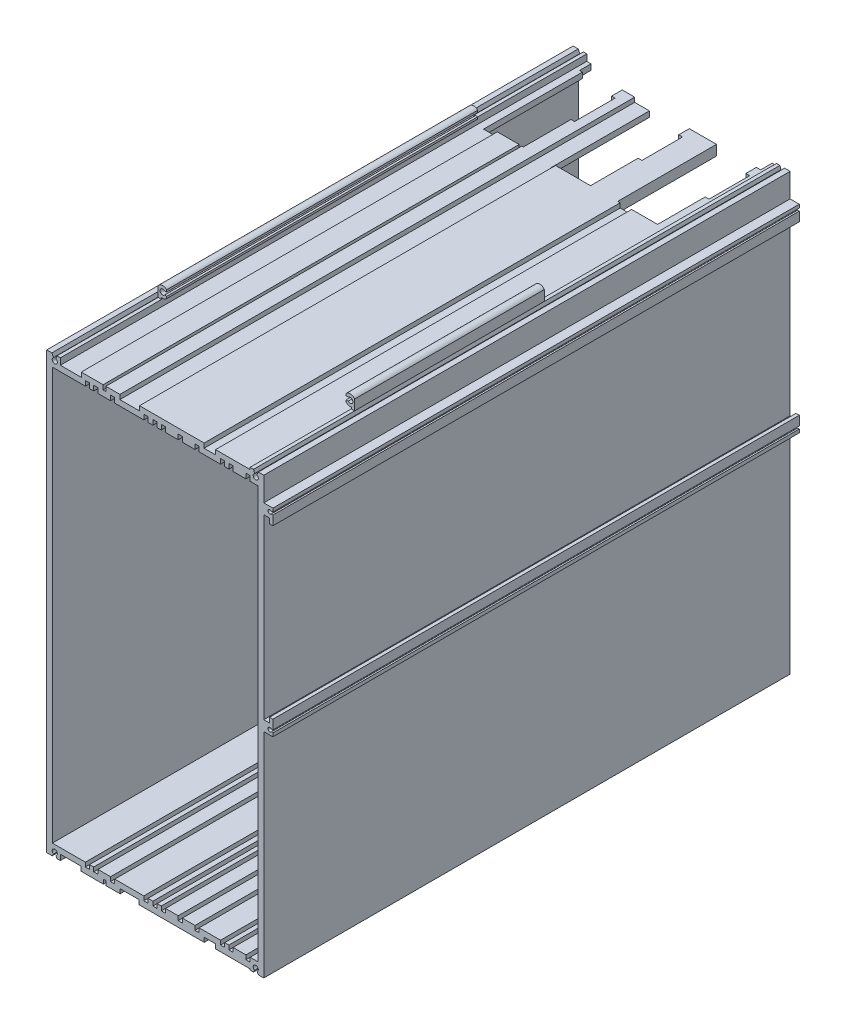
from build123d import *

# Parameters (mm, degrees)
BOSS_EXTRUDE1_DEPTH = 308
BOSS_EXTRUDE2_DEPTH = 188.8
CUT_EXTRUDE3_REACH  = 428.294
SKETCH4_W           = 77.8
SKETCH4_H           = 20.823727225
CUT_EXTRUDE4_REACH  = 424.481
SKETCH5_W           = 106
SKETCH5_H           = 6.75
CUT_EXTRUDE5_REACH  = 424.481
SKETCH6_W           = 23.35
SKETCH6_H           = 57.8
CUT_EXTRUDE6_REACH  = 429.843
SKETCH7_W           = 66.8
SKETCH7_H           = 11.633150893
CUT_EXTRUDE7_REACH  = 424.481
SKETCH8_W           = 2.25
SKETCH8_H           = 23.75


with BuildPart() as part:
    # Sketch2 → Boss-Extrude1 (new body)
    with BuildSketch(Plane.XY):
        with BuildLine():
            Line((14.499999531, 257.585773296), (14.499999531, 261.373383253))
            Line((14.499999531, 261.373383253), (12.499999531, 261.373383253))
            Line((12.499999531, 261.373383253), (11.766447114, 259.574707108))
            ThreePointArc((11.766447114, 259.574707108), (12.4449235, 259.022531512), (12.699999531, 258.185773296))
            ThreePointArc((12.699999531, 258.185773296), (10.428246686, 256.899539434), (10.494136136, 259.509312818))
            Line((10.494136136, 259.509312818), (9.499999531, 261.373383253))
            Line((9.499999531, 261.373383253), (6.499999531, 261.373383253))
            Line((6.499999531, 261.373383253), (6.499999531, 6.573383253))
            Line((6.499999531, 6.573383253), (9.699999531, 6.573383253))
            Line((9.699999531, 6.573383253), (10.453087922, 7.884956995))
            ThreePointArc((10.453087922, 7.884956995), (10.448456922, 10.483919553), (12.699999531, 9.185773296))
            ThreePointArc((12.699999531, 9.185773296), (12.47478685, 8.395256191), (11.866776475, 7.842118389))
            Line((11.866776475, 7.842118389), (12.496375142, 6.573383253))
            Line((12.496375142, 6.573383253), (14.496375142, 6.573383253))
            Line((14.496375142, 6.573383253), (14.496375142, 9.785773296))
            Line((14.496375142, 9.785773296), (26.596375142, 9.785773296))
            Line((26.596375142, 9.785773296), (26.596375142, 7.202035453))
            Line((26.596375142, 7.202035453), (39.696375142, 7.202035453))
            Line((39.696375142, 7.202035453), (39.696375142, 9.785773296))
            Line((39.696375142, 9.785773296), (41.199999531, 9.785773296))
            Line((41.199999531, 9.785773296), (41.199999531, 7.202035453))
            Line((41.199999531, 7.202035453), (49.449999531, 7.202035453))
            Line((49.449999531, 7.202035453), (49.449999531, 9.785773296))
            Line((49.449999531, 9.785773296), (60.549999531, 9.785773296))
            Line((60.549999531, 9.785773296), (60.549999531, 7.202035453))
            Line((60.549999531, 7.202035453), (98.649999531, 7.202035453))
            Line((98.649999531, 7.202035453), (98.649999531, 9.785773296))
            Line((98.649999531, 9.785773296), (105.249999531, 9.785773296))
            Line((105.249999531, 9.785773296), (105.249999531, 7.202035453))
            Line((105.249999531, 7.202035453), (125.499999531, 7.202035453))
            Line((125.499999531, 7.202035453), (125.499999531, 6.573383253))
            Line((125.499999531, 6.573383253), (127.499999531, 6.573383253))
            Line((127.499999531, 6.573383253), (128.131728013, 7.842861095))
            ThreePointArc((128.131728013, 7.842861095), (128.010191731, 10.461000193), (130.299999531, 9.185773296))
            ThreePointArc((130.299999531, 9.185773296), (130.098145789, 8.434230687), (129.54691114, 7.884956995))
            Line((129.54691114, 7.884956995), (130.299999531, 6.573383253))
            Line((130.299999531, 6.573383253), (133.499999531, 6.573383253))
            Line((133.499999531, 6.573383253), (133.499999531, 131.473383253))
            Line((133.499999531, 131.473383253), (138.849999531, 131.473383253))
            Line((138.849999531, 131.473383253), (138.849999531, 133.473383253))
            Line((138.849999531, 133.473383253), (137.935232058, 133.473383253))
            ThreePointArc((137.935232058, 133.473383253), (135.950499999, 134.164830282), (137.890474853, 134.973383253))
            Line((137.890474853, 134.973383253), (138.849999531, 134.973383253))
            Line((138.849999531, 134.973383253), (138.849999531, 140.423383253))
            Line((138.849999531, 140.423383253), (136.899999531, 140.423383253))
            Line((136.899999531, 140.423383253), (136.899999531, 137.473383253))
            Line((136.899999531, 137.473383253), (133.499999531, 137.473383253))
            Line((133.499999531, 137.473383253), (133.499999531, 241.373383253))
            Line((133.499999531, 241.373383253), (136.899999531, 241.373383253))
            Line((136.899999531, 241.373383253), (136.899999531, 238.423383253))
            Line((136.899999531, 238.423383253), (138.849999531, 238.423383253))
            Line((138.849999531, 238.423383253), (138.849999531, 243.873383253))
            Line((138.849999531, 243.873383253), (137.890474853, 243.873383253))
            ThreePointArc((137.890474853, 243.873383253), (135.950499999, 244.681936224), (137.935232058, 245.373383253))
            Line((137.935232058, 245.373383253), (138.849999531, 245.373383253))
            Line((138.849999531, 245.373383253), (138.849999531, 247.373383253))
            Line((138.849999531, 247.373383253), (133.499999531, 247.373383253))
            Line((133.499999531, 247.373383253), (133.499999531, 261.373383253))
            Line((133.499999531, 261.373383253), (130.299999531, 261.373383253))
            Line((130.299999531, 261.373383253), (129.438677048, 259.543009837))
            ThreePointArc((129.438677048, 259.543009837), (130.06649396, 258.989509485), (130.299999531, 258.185773296))
            ThreePointArc((130.299999531, 258.185773296), (127.963241315, 256.940849327), (128.233551948, 259.574707108))
            Line((128.233551948, 259.574707108), (127.499999531, 261.373383253))
            Line((127.499999531, 261.373383253), (125.499999531, 261.373383253))
            Line((125.499999531, 261.373383253), (125.499999531, 260.239968056))
            Line((125.499999531, 260.239968056), (105.299999531, 260.239968056))
            Line((105.299999531, 260.239968056), (105.299999531, 257.585773296))
            Line((105.299999531, 257.585773296), (98.599999531, 257.585773296))
            Line((98.599999531, 257.585773296), (98.599999531, 260.239968056))
            Line((98.599999531, 260.239968056), (60.799999531, 260.239968056))
            Line((60.799999531, 260.239968056), (60.799999531, 257.585773296))
            Line((60.799999531, 257.585773296), (49.299999531, 257.585773296))
            Line((49.299999531, 257.585773296), (49.299999531, 260.239968056))
            Line((49.299999531, 260.239968056), (41.099999531, 260.239968056))
            Line((41.099999531, 260.239968056), (41.099999531, 257.585773296))
            Line((41.099999531, 257.585773296), (39.499999531, 257.585773296))
            Line((39.499999531, 257.585773296), (39.499999531, 260.239968056))
            Line((39.499999531, 260.239968056), (26.699999531, 260.239968056))
            Line((26.699999531, 260.239968056), (26.699999531, 257.585773296))
            Line((26.699999531, 257.585773296), (14.499999531, 257.585773296))
        make_face()
        Polygon((9.799999531, 13.085773296), (9.799999531, 254.285773296), (29.099999531, 254.285773296), (29.099999531, 257.185773296), (31.549999531, 257.185773296), (31.549999531, 254.285773296), (33.999999531, 254.285773296), (33.999999531, 257.185773296), (36.449999531, 257.185773296), (36.449999531, 254.285773296), (43.849999531, 254.285773296), (43.849999531, 257.185773296), (46.299999531, 257.185773296), (46.299999531, 254.285773296), (63.299999531, 254.285773296), (63.299999531, 257.185773296), (65.749999531, 257.185773296), (65.749999531, 254.285773296), (68.649999531, 254.285773296), (68.649999531, 257.185773296), (71.099999531, 257.185773296), (71.099999531, 254.285773296), (73.549999531, 254.285773296), (73.549999531, 257.185773296), (75.999999531, 257.185773296), (75.999999531, 254.285773296), (83.399999531, 254.285773296), (83.399999531, 257.185773296), (85.849999531, 257.185773296), (85.849999531, 254.285773296), (93.249999531, 254.285773296), (93.249999531, 257.185773296), (95.699999531, 257.185773296), (95.699999531, 254.285773296), (108.199999531, 254.285773296), (108.199999531, 257.185773296), (110.649999531, 257.185773296), (110.649999531, 254.285773296), (113.099999531, 254.285773296), (113.099999531, 257.185773296), (115.549999531, 257.185773296), (115.549999531, 254.285773296), (123.049999531, 254.285773296), (123.049999531, 257.185773296), (125.499999531, 257.185773296), (125.499999531, 254.285773296), (130.199999531, 254.285773296), (130.199999531, 13.085773296), (125.499999531, 13.085773296), (125.499999531, 10.605647121), (123.049999531, 10.605647121), (123.049999531, 13.085773296), (115.549999531, 13.085773296), (115.549999531, 10.605647121), (113.099999531, 10.605647121), (113.099999531, 13.085773296), (110.649999531, 13.085773296), (110.649999531, 10.605647121), (108.199999531, 10.605647121), (108.199999531, 13.085773296), (95.699999531, 13.085773296), (95.699999531, 10.605647121), (93.249999531, 10.605647121), (93.249999531, 13.085773296), (85.849999531, 13.085773296), (85.849999531, 10.605647121), (83.399999531, 10.605647121), (83.399999531, 13.085773296), (75.999999531, 13.085773296), (75.999999531, 10.605647121), (73.549999531, 10.605647121), (73.549999531, 13.085773296), (71.099999531, 13.085773296), (71.099999531, 10.605647121), (68.649999531, 10.605647121), (68.649999531, 13.085773296), (65.749999531, 13.085773296), (65.749999531, 10.605647121), (63.299999531, 10.605647121), (63.299999531, 13.085773296), (46.299999531, 13.085773296), (46.299999531, 10.605647121), (43.849999531, 10.605647121), (43.849999531, 13.085773296), (36.449999531, 13.085773296), (36.449999531, 10.605647121), (33.999999531, 10.605647121), (33.999999531, 13.085773296), (31.549999531, 13.085773296), (31.549999531, 10.605647121), (29.099999531, 10.605647121), (29.099999531, 13.085773296), align=None, mode=Mode.SUBTRACT)
    extrude(amount=BOSS_EXTRUDE1_DEPTH)

    # Sketch3 → Boss-Extrude2 (add)
    with BuildSketch(Plane(origin=(0, 0, 60), x_dir=(-1, 0, 0), z_dir=(0, 0, -1))):
        with BuildLine():
            ThreePointArc((-17.499999531, 263.24640733), (-16.121371693, 262.388956123), (-14.499999531, 262.30535229))
            Line((-14.499999531, 262.30535229), (-14.499999531, 264.027871507))
            ThreePointArc((-14.499999531, 264.027871507), (-15.443429897, 263.94278526), (-16.249723759, 264.439968056))
            Line((-16.249723759, 264.439968056), (-17.499999531, 264.439968056))
            Line((-17.499999531, 264.439968056), (-17.499999531, 263.24640733))
        make_face()
        with BuildLine():
            Line((-14.499999531, 264.027871507), (-14.499999531, 262.30535229))
            ThreePointArc((-14.499999531, 262.30535229), (-13.376269152, 262.765773779), (-12.499999531, 263.606552859))
            Line((-12.499999531, 263.606552859), (-12.499999531, 267.373383253))
            ThreePointArc((-12.499999531, 267.373383253), (-13.376269152, 268.214162333), (-14.499999531, 268.674583822))
            Line((-14.499999531, 268.674583822), (-14.499999531, 266.777802835))
            ThreePointArc((-14.499999531, 266.777802835), (-13.844699353, 266.224622869), (-13.59955722, 265.402837171))
            ThreePointArc((-13.59955722, 265.402837171), (-13.844699353, 264.581051473), (-14.499999531, 264.027871507))
        make_face()
        with BuildLine():
            Line((-14.499999531, 262.30535229), (-14.499999531, 261.373383253))
            Line((-14.499999531, 261.373383253), (-12.499999531, 261.373383253))
            Line((-12.499999531, 261.373383253), (-12.499999531, 263.606552859))
            ThreePointArc((-12.499999531, 263.606552859), (-13.376269152, 262.765773779), (-14.499999531, 262.30535229))
        make_face()
        with BuildLine():
            ThreePointArc((-16.077786922, 266.539968056), (-15.323140468, 266.886080418), (-14.499999531, 266.777802835))
            Line((-14.499999531, 266.777802835), (-14.499999531, 268.674583822))
            ThreePointArc((-14.499999531, 268.674583822), (-16.121371693, 268.590979989), (-17.499999531, 267.733528783))
            Line((-17.499999531, 267.733528783), (-17.499999531, 266.539968056))
            Line((-17.499999531, 266.539968056), (-16.077786922, 266.539968056))
        make_face()
        with BuildLine():
            Line((-127.499999531, 263.606552859), (-127.499999531, 261.373383253))
            Line((-127.499999531, 261.373383253), (-125.499999531, 261.373383253))
            Line((-125.499999531, 261.373383253), (-125.499999531, 262.30535229))
            ThreePointArc((-125.499999531, 262.30535229), (-126.62372991, 262.765773779), (-127.499999531, 263.606552859))
        make_face()
        with BuildLine():
            Line((-127.499999531, 267.373383253), (-127.499999531, 263.606552859))
            ThreePointArc((-127.499999531, 263.606552859), (-126.62372991, 262.765773779), (-125.499999531, 262.30535229))
            Line((-125.499999531, 262.30535229), (-125.499999531, 264.027871507))
            ThreePointArc((-125.499999531, 264.027871507), (-126.400441842, 265.402837171), (-125.499999531, 266.777802835))
            Line((-125.499999531, 266.777802835), (-125.499999531, 268.674583822))
            ThreePointArc((-125.499999531, 268.674583822), (-126.62372991, 268.214162333), (-127.499999531, 267.373383253))
        make_face()
        with BuildLine():
            ThreePointArc((-122.499999531, 267.733528783), (-123.878627369, 268.590979989), (-125.499999531, 268.674583822))
            Line((-125.499999531, 268.674583822), (-125.499999531, 266.777802835))
            ThreePointArc((-125.499999531, 266.777802835), (-124.676858594, 266.886080418), (-123.922212141, 266.539968056))
            Line((-123.922212141, 266.539968056), (-122.499999531, 266.539968056))
            Line((-122.499999531, 266.539968056), (-122.499999531, 267.733528783))
        make_face()
        with BuildLine():
            Line((-125.499999531, 264.027871507), (-125.499999531, 262.30535229))
            ThreePointArc((-125.499999531, 262.30535229), (-123.878627369, 262.388956123), (-122.499999531, 263.24640733))
            Line((-122.499999531, 263.24640733), (-122.499999531, 264.439968056))
            Line((-122.499999531, 264.439968056), (-123.750275303, 264.439968056))
            ThreePointArc((-123.750275303, 264.439968056), (-124.556569165, 263.94278526), (-125.499999531, 264.027871507))
        make_face()
    extrude(amount=-BOSS_EXTRUDE2_DEPTH)

    # Sketch4 → Cut-Extrude3 (cut, up to next)
    with BuildSketch(Plane(origin=(127.499999531, 0, 0), x_dir=(0, 0, -1), z_dir=(1, 0, 0)), mode=Mode.PRIVATE) as cut_extrude3_sk1:
        with Locations((-98.9, 271.785246866)):
            Rectangle(SKETCH4_W, SKETCH4_H)
    cut_extrude3_tool1 = extrude(cut_extrude3_sk1.sketch, amount=-CUT_EXTRUDE3_REACH, mode=Mode.PRIVATE) & part.part
    add(cut_extrude3_tool1.solids().sort_by_distance((127.5, 271.785247, 98.9))[0], mode=Mode.SUBTRACT)

    # Sketch5 → Cut-Extrude4 (cut, up to next)
    with BuildSketch(Plane(origin=(0, 260.239968056, 0), x_dir=(1, 0, 0), z_dir=(0, 1, 0)), mode=Mode.PRIVATE) as cut_extrude4_sk1:
        with Locations((69.999999531, -3.375)):
            Rectangle(SKETCH5_W, SKETCH5_H)
    cut_extrude4_tool1 = extrude(cut_extrude4_sk1.sketch, amount=-CUT_EXTRUDE4_REACH, mode=Mode.PRIVATE) & part.part
    add(cut_extrude4_tool1.solids().sort_by_distance((70, 260.239968, 3.375))[0], mode=Mode.SUBTRACT)

    # Sketch6 → Cut-Extrude5 (cut, up to next)
    with BuildSketch(Plane(origin=(0, 260.239968056, 0), x_dir=(1, 0, 0), z_dir=(0, 1, 0)), mode=Mode.PRIVATE) as cut_extrude5_sk1:
        with Locations((108.824999531, -35.65)):
            Rectangle(SKETCH6_W, SKETCH6_H)
    cut_extrude5_tool1 = extrude(cut_extrude5_sk1.sketch, amount=-CUT_EXTRUDE5_REACH, mode=Mode.PRIVATE) & part.part
    # Sketch6 → Cut-Extrude5 (cut, up to next)
    with BuildSketch(Plane(origin=(0, 260.239968056, 0), x_dir=(1, 0, 0), z_dir=(0, 1, 0)), mode=Mode.PRIVATE) as cut_extrude5_sk2:
        with Locations((69.574999531, -35.65)):
            Rectangle(SKETCH6_W, SKETCH6_H)
    cut_extrude5_tool2 = extrude(cut_extrude5_sk2.sketch, amount=-CUT_EXTRUDE5_REACH, mode=Mode.PRIVATE) & part.part
    # Sketch6 → Cut-Extrude5 (cut, up to next)
    with BuildSketch(Plane(origin=(0, 260.239968056, 0), x_dir=(1, 0, 0), z_dir=(0, 1, 0)), mode=Mode.PRIVATE) as cut_extrude5_sk3:
        with Locations((30.324999531, -35.65)):
            Rectangle(SKETCH6_W, SKETCH6_H)
    cut_extrude5_tool3 = extrude(cut_extrude5_sk3.sketch, amount=-CUT_EXTRUDE5_REACH, mode=Mode.PRIVATE) & part.part
    add(cut_extrude5_tool1.solids().sort_by_distance((108.825, 260.239968, 35.65))[0], mode=Mode.SUBTRACT)
    add(cut_extrude5_tool2.solids().sort_by_distance((69.575, 260.239968, 35.65))[0], mode=Mode.SUBTRACT)
    add(cut_extrude5_tool3.solids().sort_by_distance((30.325, 260.239968, 35.65))[0], mode=Mode.SUBTRACT)

    # Sketch7 → Cut-Extrude6 (cut, up to next)
    with BuildSketch(Plane.ZY.offset(-12.499999531), mode=Mode.PRIVATE) as cut_extrude6_sk1:
        with Locations((33.4, 267.1899587)):
            Rectangle(SKETCH7_W, SKETCH7_H)
    cut_extrude6_tool1 = extrude(cut_extrude6_sk1.sketch, amount=-CUT_EXTRUDE6_REACH, mode=Mode.PRIVATE) & part.part
    add(cut_extrude6_tool1.solids().sort_by_distance((12.5, 267.189959, 33.4))[0], mode=Mode.SUBTRACT)

    # Sketch8 → Cut-Extrude7 (cut, up to next)
    with BuildSketch(Plane(origin=(0, 260.239968056, 0), x_dir=(1, 0, 0), z_dir=(0, 1, 0)), mode=Mode.PRIVATE) as cut_extrude7_sk1:
        with Locations((121.624999531, -24.825)):
            Rectangle(SKETCH8_W, SKETCH8_H)
    cut_extrude7_tool1 = extrude(cut_extrude7_sk1.sketch, amount=-CUT_EXTRUDE7_REACH, mode=Mode.PRIVATE) & part.part
    # Sketch8 → Cut-Extrude7 (cut, up to next)
    with BuildSketch(Plane(origin=(0, 260.239968056, 0), x_dir=(1, 0, 0), z_dir=(0, 1, 0)), mode=Mode.PRIVATE) as cut_extrude7_sk2:
        with Locations((82.374999531, -24.825)):
            Rectangle(SKETCH8_W, SKETCH8_H)
    cut_extrude7_tool2 = extrude(cut_extrude7_sk2.sketch, amount=-CUT_EXTRUDE7_REACH, mode=Mode.PRIVATE) & part.part
    # Sketch8 → Cut-Extrude7 (cut, up to next)
    with BuildSketch(Plane(origin=(0, 260.239968056, 0), x_dir=(1, 0, 0), z_dir=(0, 1, 0)), mode=Mode.PRIVATE) as cut_extrude7_sk3:
        with Locations((42.958678124, -24.825)):
            Rectangle(SKETCH8_W, SKETCH8_H)
    cut_extrude7_tool3 = extrude(cut_extrude7_sk3.sketch, amount=-CUT_EXTRUDE7_REACH, mode=Mode.PRIVATE) & part.part
    add(cut_extrude7_tool1.solids().sort_by_distance((121.625, 260.239968, 24.825))[0], mode=Mode.SUBTRACT)
    add(cut_extrude7_tool2.solids().sort_by_distance((82.375, 260.239968, 24.825))[0], mode=Mode.SUBTRACT)
    add(cut_extrude7_tool3.solids().sort_by_distance((42.958678, 260.239968, 24.825))[0], mode=Mode.SUBTRACT)


solid = part.part
